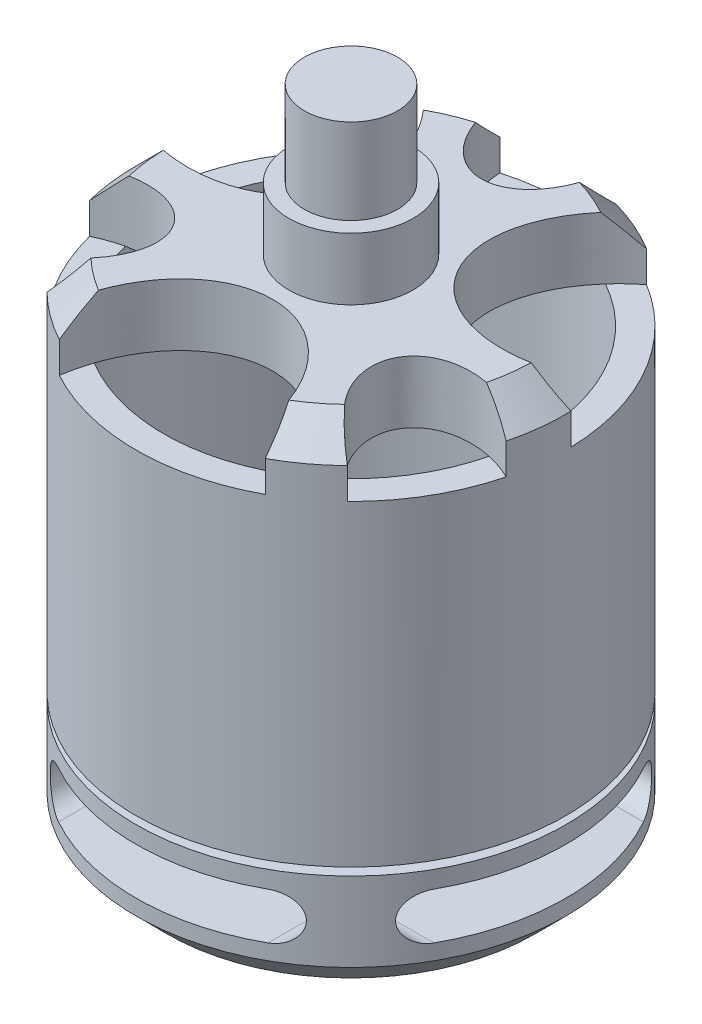
from build123d import *

# Parameters (mm, degrees)
CHAMFER1_SIZE      = 2
SKETCH2_RX         = 8.815168497
SKETCH2_RY         = 6.763008786
SKETCH2_RX_2       = 5.446652698
SKETCH2_RY_2       = 3.762863515
CUT_EXTRUDE1_DEPTH = 4
CIRPATTERN1_COUNT  = 3
SKETCH3_R          = 12.054961978
CUT_EXTRUDE2_DEPTH = 20
CUT_EXTRUDE3_DEPTH = 46.890031658
CIRPATTERN3_COUNT  = 2
CIRPATTERN3_ANGLE  = 90
SKETCH5_R          = 1.75
CUT_EXTRUDE4_DEPTH = 1


with BuildPart() as part:
    # Sketch1 → Revolve1 (revolve)
    with BuildSketch(Plane.XY):
        Polygon((-3.2, 0), (-13.85, 0), (-13.85, 7.1), (-12.85, 7.1), (-12.85, 7.6), (-13.85, 7.6), (-13.85, 32), (-4, 32), (-4, 36), (-3, 36), (-3, 41.5), (0, 41.5), (0, -2.5), (-3.2, -2.5), align=None)
    revolve(axis=Axis((0, 41.5, 0), (0, -1, 0)))

    # Chamfer1
    chamfer1_edges = [part.edges().sort_by_distance(p)[0] for p in [
        (13.85, 0, 0),
        (13.85, 32, 0),
    ]]
    chamfer(chamfer1_edges, length=CHAMFER1_SIZE)

    # Sketch2 → Cut-Extrude1 (cut)
    with BuildSketch(Plane(origin=(0, 32, 0), x_dir=(1, 0, 0), z_dir=(0, 1, 0))):
        with Locations(Location((0, -13.85), (0, 0, 90))):
            Ellipse(SKETCH2_RX, SKETCH2_RY)
        with Locations(Location((0, 13.85), (0, 0, -90))):
            Ellipse(SKETCH2_RX_2, SKETCH2_RY_2)
        with Locations(Location((-77.957366116, 6.373706544), (0, 0, 90))):
            Ellipse(SKETCH2_RX, SKETCH2_RY)
        with Locations(Location((-77.957366116, 34.073706544), (0, 0, 90))):
            Ellipse(SKETCH2_RX_2, SKETCH2_RY_2)
    cut_extrude1 = extrude(amount=-CUT_EXTRUDE1_DEPTH, mode=Mode.SUBTRACT)

    # CirPattern1: Cut-Extrude1 ×3 about axis
    cirpattern1_axis = Axis((0, 41.5, 0), (0, 1, 0))
    for i in range(1, CIRPATTERN1_COUNT):
        add(cut_extrude1.rotate(cirpattern1_axis, i * 360 / CIRPATTERN1_COUNT), mode=Mode.SUBTRACT)

    # Sketch3 → Cut-Extrude2 (cut)
    with BuildSketch(Plane(origin=(0, 28, 0), x_dir=(1, 0, 0), z_dir=(0, 1, 0))):
        with Locations(Location((0, 0, 0), (0, 0, 180))):
            Circle(SKETCH3_R)
    extrude(amount=-CUT_EXTRUDE2_DEPTH, mode=Mode.SUBTRACT)

    # Sketch4 → Cut-Extrude3 (cut, symmetric)
    with BuildSketch(Plane(origin=(0, 0, 0), x_dir=(0, 0, -1), z_dir=(1, 0, 0))):
        with BuildLine():
            Line((-6.75, 6), (6.75, 6))
            ThreePointArc((6.75, 6), (8.25, 4.5), (6.75, 3))
            Line((6.75, 3), (-6.75, 3))
            ThreePointArc((-6.75, 3), (-8.25, 4.5), (-6.75, 6))
        make_face()
    cut_extrude3 = extrude(amount=CUT_EXTRUDE3_DEPTH, both=True, mode=Mode.SUBTRACT)

    # CirPattern3: Cut-Extrude3 ×2 about axis
    cirpattern3_axis = Axis((0, 41.5, 0), (0, 1, 0))
    for i in range(1, CIRPATTERN3_COUNT):
        add(cut_extrude3.rotate(cirpattern3_axis, i * CIRPATTERN3_ANGLE / (CIRPATTERN3_COUNT - 1)), mode=Mode.SUBTRACT)

    # Sketch5 → Cut-Extrude4 (cut)
    with BuildSketch(Plane.XZ):
        with Locations((-9.5, 0)):
            Circle(SKETCH5_R)
        with Locations((0, 8)):
            Circle(SKETCH5_R)
        with Locations((9.5, 0)):
            Circle(SKETCH5_R)
        with Locations((0, -8)):
            Circle(SKETCH5_R)
    extrude(amount=-CUT_EXTRUDE4_DEPTH, mode=Mode.SUBTRACT)


solid = part.part
